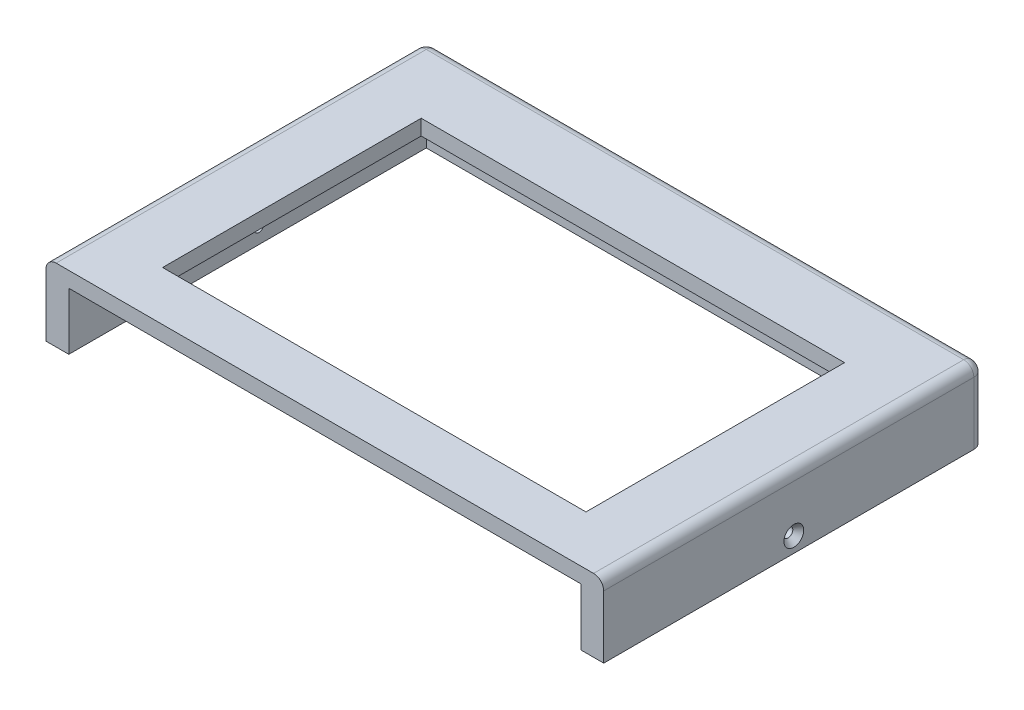
from build123d import *

# Parameters (mm, degrees)
BOSS_EXTRUDE1_DEPTH                               = 22.59
SKETCH2_W                                         = 220
SKETCH2_H                                         = 150
SKETCH2_W_2                                       = 167
SKETCH2_H_2                                       = 102
BOSS_EXTRUDE2_DEPTH                               = 6.08
CSK_FOR_6_FLAT_HEAD_SOCKET_CAP_SCREW2_D           = 3.7973
CSK_FOR_6_FLAT_HEAD_SOCKET_CAP_SCREW2_DEPTH       = 9
CSK_FOR_6_FLAT_HEAD_SOCKET_CAP_SCREW2_CSINK_D     = 7.7978
CSK_FOR_6_FLAT_HEAD_SOCKET_CAP_SCREW2_CSINK_ANGLE = 82
CSK_FOR_6_FLAT_HEAD_SOCKET_CAP_SCREW3_D           = 3.7973
CSK_FOR_6_FLAT_HEAD_SOCKET_CAP_SCREW3_CSINK_D     = 7.7978
CSK_FOR_6_FLAT_HEAD_SOCKET_CAP_SCREW3_CSINK_ANGLE = 82
CSK_FOR_6_FLAT_HEAD_SOCKET_CAP_SCREW4_D           = 3.7973
CSK_FOR_6_FLAT_HEAD_SOCKET_CAP_SCREW4_CSINK_D     = 7.7978
CSK_FOR_6_FLAT_HEAD_SOCKET_CAP_SCREW4_CSINK_ANGLE = 82
FILLET1_R                                         = 4


with BuildPart() as part:
    # Sketch1 → Boss-Extrude1 (new body)
    with BuildSketch(Plane(origin=(0, 0, 0), x_dir=(1, 0, 0), z_dir=(0, 1, 0))):
        Polygon((211, 0), (220, 0), (220, 150), (0, 150), (0, 0), (9, 0), (9, 141), (211, 141), align=None)
    extrude(amount=BOSS_EXTRUDE1_DEPTH)

    # Sketch2 → Boss-Extrude2 (add)
    with BuildSketch(Plane(origin=(0, 22.59, 0), x_dir=(1, 0, 0), z_dir=(0, 1, 0))):
        with Locations((110, 75)):
            Rectangle(SKETCH2_W, SKETCH2_H)
        with Locations((110, 70.5)):
            Rectangle(SKETCH2_W_2, SKETCH2_H_2, mode=Mode.SUBTRACT)
    extrude(amount=BOSS_EXTRUDE2_DEPTH)

    # CSK for #6 Flat Head Socket Cap Screw2
    with Locations(Plane(origin=(220, 0, 0), x_dir=(0, 0, -1), z_dir=(1, 0, 0))):
        with Locations((75, 6)):
            CounterSinkHole(CSK_FOR_6_FLAT_HEAD_SOCKET_CAP_SCREW2_D / 2, CSK_FOR_6_FLAT_HEAD_SOCKET_CAP_SCREW2_CSINK_D / 2, depth=CSK_FOR_6_FLAT_HEAD_SOCKET_CAP_SCREW2_DEPTH, counter_sink_angle=CSK_FOR_6_FLAT_HEAD_SOCKET_CAP_SCREW2_CSINK_ANGLE)

    # CSK for #6 Flat Head Socket Cap Screw3 (through all)
    with Locations(Plane(origin=(0, 0, -150), x_dir=(-1, 0, 0), z_dir=(0, 0, -1))):
        with Locations((-110, 6)):
            CounterSinkHole(CSK_FOR_6_FLAT_HEAD_SOCKET_CAP_SCREW3_D / 2, CSK_FOR_6_FLAT_HEAD_SOCKET_CAP_SCREW3_CSINK_D / 2, counter_sink_angle=CSK_FOR_6_FLAT_HEAD_SOCKET_CAP_SCREW3_CSINK_ANGLE)

    # CSK for #6 Flat Head Socket Cap Screw4 (through all)
    with Locations(Plane.ZY):
        with Locations((-75, 6)):
            CounterSinkHole(CSK_FOR_6_FLAT_HEAD_SOCKET_CAP_SCREW4_D / 2, CSK_FOR_6_FLAT_HEAD_SOCKET_CAP_SCREW4_CSINK_D / 2, counter_sink_angle=CSK_FOR_6_FLAT_HEAD_SOCKET_CAP_SCREW4_CSINK_ANGLE)

    # Fillet1
    fillet1_edges = [part.edges().sort_by_distance(p)[0] for p in [
        (0, 14.335, -150),
        (220, 14.335, -150),
        (0, 28.67, -75),
        (220, 28.67, -75),
        (110, 28.67, -150),
    ]]
    fillet(fillet1_edges, radius=FILLET1_R)


solid = part.part
